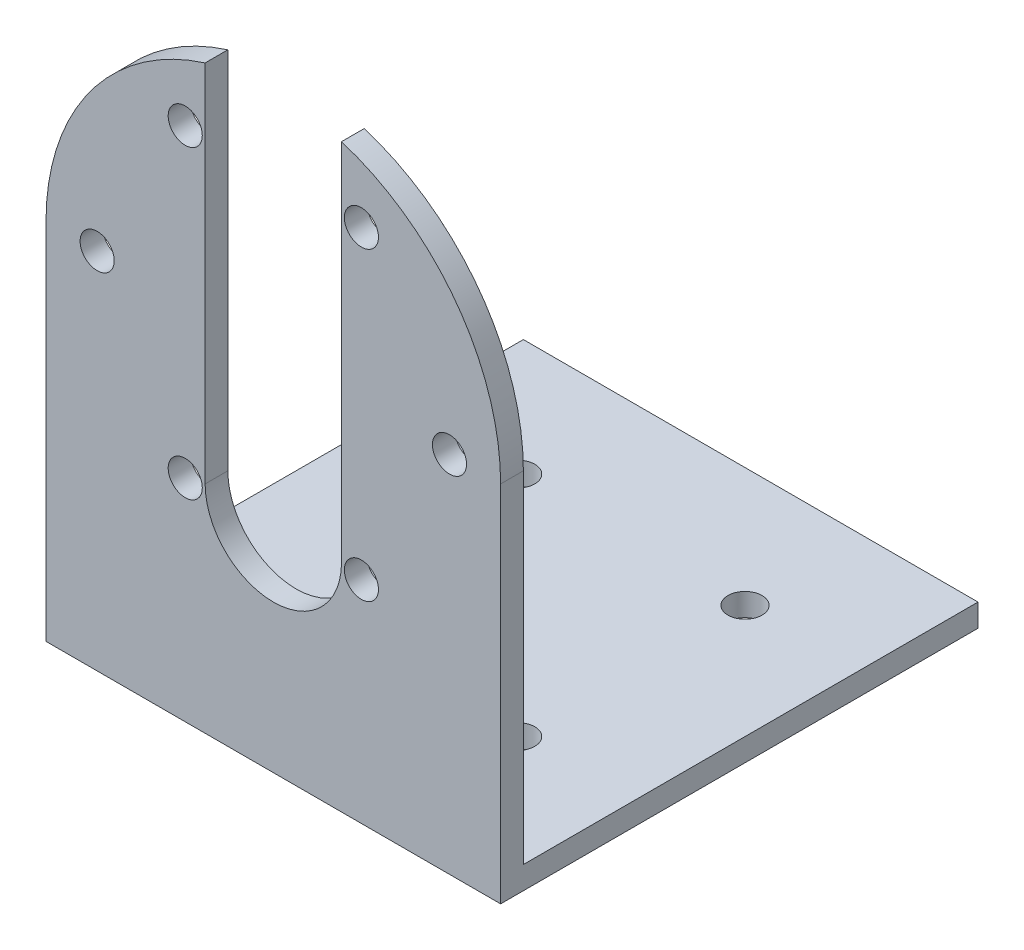
from build123d import *

# Parameters (mm, degrees)
SKETCH1_W           = 40
SKETCH1_H           = 42
BOSS_EXTRUDE1_DEPTH = 2
SKETCH2_W           = 40
SKETCH2_H           = 2
BOSS_EXTRUDE2_DEPTH = 50
CUT_EXTRUDE1_DEPTH  = 50
SKETCH4_R           = 1.5
CUT_EXTRUDE2_DEPTH  = 50
CUT_EXTRUDE3_DEPTH  = 1033
SKETCH6_R           = 1.5
CUT_EXTRUDE4_DEPTH  = 1033


with BuildPart() as part:
    # Sketch1 → Boss-Extrude1 (new body)
    with BuildSketch(Plane(origin=(0, 0, 0), x_dir=(1, 0, 0), z_dir=(0, 1, 0))):
        Rectangle(SKETCH1_W, SKETCH1_H)
    extrude(amount=BOSS_EXTRUDE1_DEPTH)

    # Sketch2 → Boss-Extrude2 (add)
    with BuildSketch(Plane(origin=(0, 2, 0), x_dir=(1, 0, 0), z_dir=(0, 1, 0))):
        with Locations((0, -20)):
            Rectangle(SKETCH2_W, SKETCH2_H)
    extrude(amount=BOSS_EXTRUDE2_DEPTH)

    # Sketch3 → Cut-Extrude1 (cut)
    with BuildSketch(Plane.XY.offset(21)):
        with BuildLine():
            Line((-20, 52), (-20, 32))
            ThreePointArc((-20, 32), (-14.142135619, 46.142135629), (1.4e-08, 52))
            Line((1.4e-08, 52), (-20, 52))
        make_face()
        with BuildLine():
            Line((20, 52), (1.4e-08, 52))
            ThreePointArc((1.4e-08, 52), (14.142135629, 46.142135619), (20, 32))
            Line((20, 32), (20, 52))
        make_face()
    extrude(amount=-CUT_EXTRUDE1_DEPTH, mode=Mode.SUBTRACT)

    # Sketch4 → Cut-Extrude2 (cut)
    with BuildSketch(Plane.XY.offset(21)):
        with Locations((-15.5, 32)):
            Circle(SKETCH4_R)
        with Locations((15.5, 32)):
            Circle(SKETCH4_R)
        with Locations((7.75, 18.576606241)):
            Circle(SKETCH4_R)
        with Locations((-7.75, 18.576606241)):
            Circle(SKETCH4_R)
        with Locations((-7.75, 45.423393759)):
            Circle(SKETCH4_R)
        with Locations((7.75, 45.423393759)):
            Circle(SKETCH4_R)
    extrude(amount=-CUT_EXTRUDE2_DEPTH, mode=Mode.SUBTRACT)

    # Sketch5 → Cut-Extrude3 (cut)
    with BuildSketch(Plane.XY.offset(21)):
        with BuildLine():
            ThreePointArc((6, 51.078784028), (0, 52), (-6, 51.078784028))
            Line((-6, 51.078784028), (-6, 19))
            ThreePointArc((-6, 19), (0, 13), (6, 19))
            Line((6, 19), (6, 51.078784028))
        make_face()
    extrude(amount=-CUT_EXTRUDE3_DEPTH, mode=Mode.SUBTRACT)

    # Sketch6 → Cut-Extrude4 (cut)
    with BuildSketch(Plane.XZ):
        with Locations(Location((-10, 9.5, 0), (0, 0, 270))):
            Circle(SKETCH6_R)
        with Locations(Location((10, 9.5, 0), (0, 0, 270))):
            Circle(SKETCH6_R)
        with Locations(Location((10, -10.5, 0), (0, 0, 270))):
            Circle(SKETCH6_R)
        with Locations(Location((-10, -10.5, 0), (0, 0, 270))):
            Circle(SKETCH6_R)
    extrude(amount=-CUT_EXTRUDE4_DEPTH, mode=Mode.SUBTRACT)


solid = part.part
